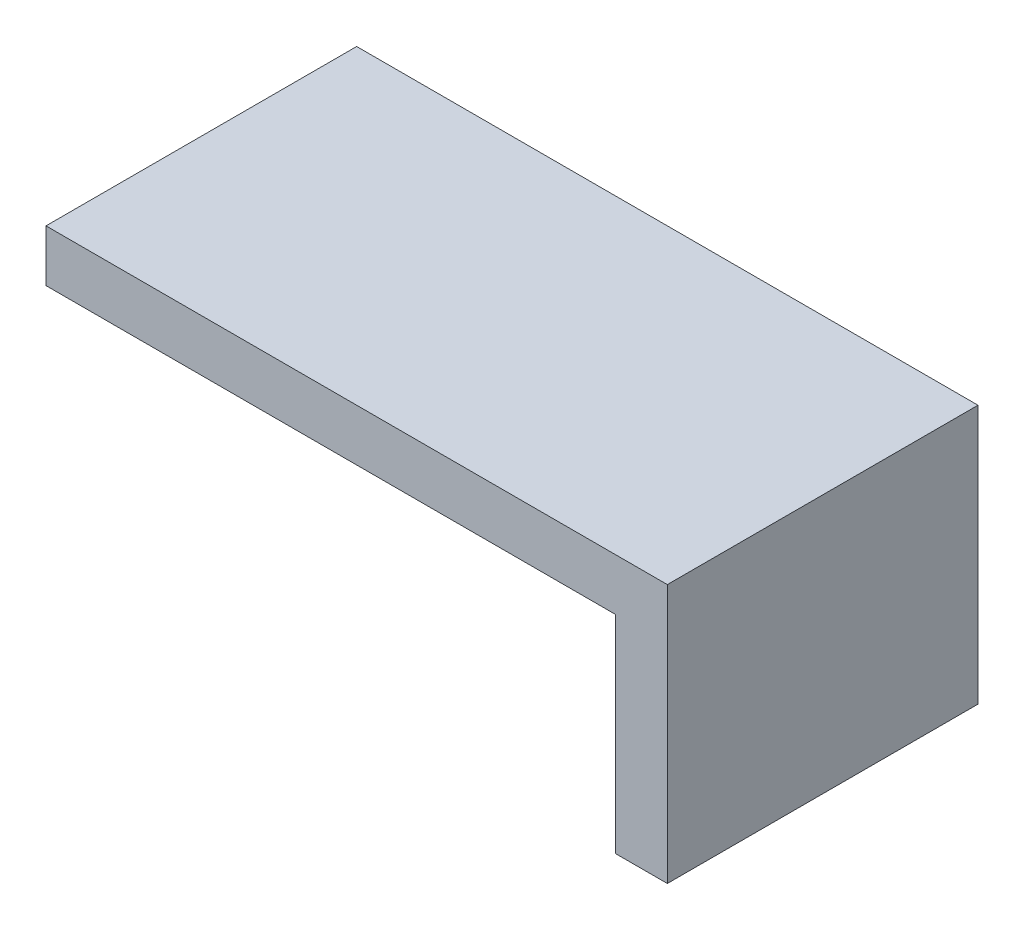
from build123d import *

# Parameters (mm, degrees)
SKETCH1_W           = 60
SKETCH1_H           = 30
BOSS_EXTRUDE1_DEPTH = 5
SKETCH2_W           = 5
SKETCH2_H           = 30
BOSS_EXTRUDE2_DEPTH = 20


with BuildPart() as part:
    # Sketch1 → Boss-Extrude1 (new body)
    with BuildSketch(Plane(origin=(0, 0, 0), x_dir=(1, 0, 0), z_dir=(0, 1, 0))):
        with Locations((30, 15)):
            Rectangle(SKETCH1_W, SKETCH1_H)
    extrude(amount=BOSS_EXTRUDE1_DEPTH)

    # Sketch2 → Boss-Extrude2 (add)
    with BuildSketch(Plane.XZ):
        with Locations((57.5, -15)):
            Rectangle(SKETCH2_W, SKETCH2_H)
    extrude(amount=BOSS_EXTRUDE2_DEPTH)


solid = part.part
